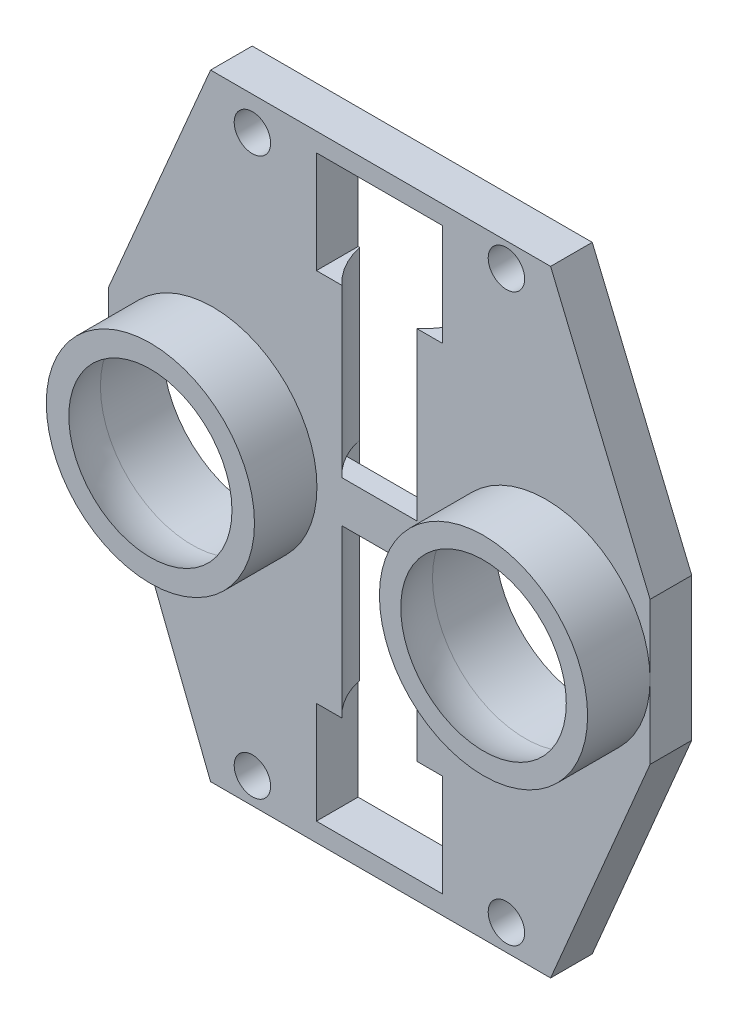
from build123d import *

# Parameters (mm, degrees)
CROQUIS1_W               = 22
CROQUIS1_H               = 55.2
SALIENTE_EXTRUIR1_DEPTH  = 4
CROQUIS2_W               = 12.1
CROQUIS2_H               = 4
CORTAR_EXTRUIR1_DEPTH    = 9.6
CROQUIS3_W               = 12.1
CROQUIS3_H               = 4
CORTAR_EXTRUIR2_DEPTH    = 9.6
CORTAR_EXTRUIR3_DEPTH    = 16
CORTAR_EXTRUIR4_START    = -16
CORTAR_EXTRUIR4_DEPTH    = 16
CROQUIS9_W               = 11.778481694
CROQUIS9_H               = 4
CORTAR_EXTRUIR5_DEPTH    = 2
CROQUIS11_W              = 4.95
CROQUIS11_H              = 4
SALIENTE_EXTRUIR3_DEPTH  = 2
CROQUIS12_W              = 4
CROQUIS12_H              = 1.8
SALIENTE_EXTRUIR4_DEPTH  = 12.1
CROQUIS13_W              = 4.95
CROQUIS13_H              = 4
SALIENTE_EXTRUIR5_DEPTH  = 2
CROQUIS14_W              = 4
CROQUIS14_H              = 1.8
SALIENTE_EXTRUIR6_DEPTH  = 12.1
CROQUIS17_W              = 4
CROQUIS17_H              = 59.2
SALIENTE_EXTRUIR8_DEPTH  = 15
CROQUIS18_W              = 4
CROQUIS18_H              = 59.2
SALIENTE_EXTRUIR9_DEPTH  = 15
CROQUIS19_R              = 1.75
CORTAR_EXTRUIR6_DEPTH    = 11.5
CROQUIS20_R              = 8.8
CROQUIS20_R_2            = 8.901027098
CORTAR_EXTRUIR7_DEPTH    = 4
CROQUIS22_R              = 10
SALIENTE_EXTRUIR10_DEPTH = 6
CORTAR_EXTRUIR8_DEPTH    = 10
CROQUIS26_R              = 8.901027098
CROQUIS26_R_2            = 8.8
CORTAR_EXTRUIR9_DEPTH    = 2


with BuildPart() as part:
    # Croquis1 → Saliente-Extruir1 (new body)
    with BuildSketch(Plane.XY):
        with Locations((11, 27.6)):
            Rectangle(CROQUIS1_W, CROQUIS1_H)
    extrude(amount=SALIENTE_EXTRUIR1_DEPTH)

    # Croquis2 → Cortar-Extruir1 (cut)
    with BuildSketch(Plane(origin=(0, 55.2, 0), x_dir=(1, 0, 0), z_dir=(0, 1, 0))):
        with Locations((11, -2)):
            Rectangle(CROQUIS2_W, CROQUIS2_H)
    extrude(amount=-CORTAR_EXTRUIR1_DEPTH, mode=Mode.SUBTRACT)

    # Croquis3 → Cortar-Extruir2 (cut)
    with BuildSketch(Plane.XZ):
        with Locations((11, 2)):
            Rectangle(CROQUIS3_W, CROQUIS3_H)
    extrude(amount=-CORTAR_EXTRUIR2_DEPTH, mode=Mode.SUBTRACT)

    # Croquis5 → Cortar-Extruir3 (cut)
    with BuildSketch(Plane.XZ.offset(-9.6)):
        with BuildLine():
            Line((7.4, 4), (14.6, 4))
            ThreePointArc((14.6, 4), (16.401151853, 1.506649462), (17.05, -1.5))
            Line((17.05, -1.5), (4.95, -1.5))
            ThreePointArc((4.95, -1.5), (5.598848147, 1.506649462), (7.4, 4))
        make_face()
    extrude(amount=-CORTAR_EXTRUIR3_DEPTH, mode=Mode.SUBTRACT)

    # Croquis7 → Cortar-Extruir4 (cut)
    with BuildSketch(Plane(origin=(0, 45.6, 0), x_dir=(1, 0, 0), z_dir=(0, 1, 0)).offset(CORTAR_EXTRUIR4_START)):
        with BuildLine():
            Line((4.95, 1.5), (17.05, 1.5))
            ThreePointArc((17.05, 1.5), (16.401151853, -1.506649462), (14.6, -4))
            Line((14.6, -4), (7.4, -4))
            ThreePointArc((7.4, -4), (5.598848147, -1.506649462), (4.95, 1.5))
        make_face()
    extrude(amount=CORTAR_EXTRUIR4_DEPTH, mode=Mode.SUBTRACT)

    # Croquis9 → Cortar-Extruir5 (cut)
    with BuildSketch(Plane(origin=(0, 0, 0), x_dir=(-1, 0, 0), z_dir=(0, 0, -1))):
        with Locations((-11, 27.6)):
            Rectangle(CROQUIS9_W, CROQUIS9_H)
    extrude(amount=-CORTAR_EXTRUIR5_DEPTH, mode=Mode.SUBTRACT)

    # Croquis11 → Saliente-Extruir3 (add)
    with BuildSketch(Plane(origin=(0, 55.2, 0), x_dir=(1, 0, 0), z_dir=(0, 1, 0))):
        with Locations((2.475, -2)):
            Rectangle(CROQUIS11_W, CROQUIS11_H)
        with Locations((19.525, -2)):
            Rectangle(CROQUIS11_W, CROQUIS11_H)
    extrude(amount=SALIENTE_EXTRUIR3_DEPTH)

    # Croquis12 → Saliente-Extruir4 (add)
    with BuildSketch(Plane(origin=(4.95, 0, 0), x_dir=(0, 0, -1), z_dir=(1, 0, 0))):
        with Locations((-2, 56.3)):
            Rectangle(CROQUIS12_W, CROQUIS12_H)
    extrude(amount=SALIENTE_EXTRUIR4_DEPTH)

    # Croquis13 → Saliente-Extruir5 (add)
    with BuildSketch(Plane.XZ):
        with Locations((19.525, 2)):
            Rectangle(CROQUIS13_W, CROQUIS13_H)
        with Locations((2.475, 2)):
            Rectangle(CROQUIS13_W, CROQUIS13_H)
    extrude(amount=SALIENTE_EXTRUIR5_DEPTH)

    # Croquis14 → Saliente-Extruir6 (add)
    with BuildSketch(Plane(origin=(4.95, 0, 0), x_dir=(0, 0, -1), z_dir=(1, 0, 0))):
        with Locations((-2, -1.1)):
            Rectangle(CROQUIS14_W, CROQUIS14_H)
    extrude(amount=SALIENTE_EXTRUIR6_DEPTH)

    # Croquis17 → Saliente-Extruir8 (add)
    with BuildSketch(Plane.ZY):
        with Locations((2, 27.6)):
            Rectangle(CROQUIS17_W, CROQUIS17_H)
    extrude(amount=SALIENTE_EXTRUIR8_DEPTH)

    # Croquis18 → Saliente-Extruir9 (add)
    with BuildSketch(Plane(origin=(22, 0, 0), x_dir=(0, 0, -1), z_dir=(1, 0, 0))):
        with Locations((-2, 27.6)):
            Rectangle(CROQUIS18_W, CROQUIS18_H)
    extrude(amount=SALIENTE_EXTRUIR9_DEPTH)

    # Croquis19 → Cortar-Extruir6 (cut)
    with BuildSketch(Plane(origin=(0, 0, 0), x_dir=(-1, 0, 0), z_dir=(0, 0, -1))):
        with Locations((-23.2, 54.9)):
            Circle(CROQUIS19_R)
        with Locations((1.2, 54)):
            Circle(CROQUIS19_R)
        with Locations((1.2, 0.5)):
            Circle(CROQUIS19_R)
        with Locations((-23.2, 0.5)):
            Circle(CROQUIS19_R)
    extrude(amount=-CORTAR_EXTRUIR6_DEPTH, mode=Mode.SUBTRACT)

    # Croquis20 → Cortar-Extruir7 (cut)
    with BuildSketch(Plane(origin=(0, 0, 0), x_dir=(-1, 0, 0), z_dir=(0, 0, -1))):
        with Locations((5, 27.6)):
            Circle(CROQUIS20_R)
        with Locations((-27, 27.6)):
            Circle(CROQUIS20_R_2)
    extrude(amount=-CORTAR_EXTRUIR7_DEPTH, mode=Mode.SUBTRACT)

    # Croquis22 → Saliente-Extruir10 (add)
    with BuildSketch(Plane.XY.offset(4)):
        with Locations(Location((-5, 27.6, 0), (0, 0, 180))):
            Circle(CROQUIS22_R)
        with Locations((27, 27.6)):
            Circle(CROQUIS22_R)
    extrude(amount=SALIENTE_EXTRUIR10_DEPTH)

    # Croquis25 → Cortar-Extruir8 (cut)
    with BuildSketch(Plane(origin=(0, 0, 0), x_dir=(-1, 0, 0), z_dir=(0, 0, -1))):
        Polygon((-27.444270401, 57.2), (-37, 34.275770323), (-37, 57.2), align=None)
        Polygon((5.217973102, 57.2), (15, 34.275770323), (15, 57.2), align=None)
        Polygon((-37, 20.547067511), (-27.444270401, -2), (-37, -2), align=None)
        Polygon((5.217973102, -2), (15, 22.810040502), (15, -2), align=None)
    extrude(amount=-CORTAR_EXTRUIR8_DEPTH, mode=Mode.SUBTRACT)

    # Croquis26 → Cortar-Extruir9 (cut)
    with BuildSketch(Plane(origin=(0, 0, 4), x_dir=(-1, 0, 0), z_dir=(0, 0, -1))):
        with Locations((-27, 27.6)):
            Circle(CROQUIS26_R)
        with Locations((5, 27.6)):
            Circle(CROQUIS26_R_2)
    extrude(amount=-CORTAR_EXTRUIR9_DEPTH, mode=Mode.SUBTRACT)

    # Croquis27 → Cortar-Revolución1 (revolve, cut)
    with BuildSketch(Plane(origin=(0, 0, 6), x_dir=(-1, 0, 0), z_dir=(0, 0, -1))):
        with BuildLine():
            Line((5, 36.4), (5, 18.8))
            ThreePointArc((5, 18.8), (13.8, 27.6), (5, 36.4))
        make_face()
    revolve(axis=Axis((-5, 36.4, 6), (0, -1, 0)), mode=Mode.SUBTRACT)

    # Croquis28 → Cortar-Revolución2 (revolve, cut)
    with BuildSketch(Plane(origin=(0, 0, 6), x_dir=(-1, 0, 0), z_dir=(0, 0, -1))):
        with BuildLine():
            Line((-27, 36.501027098), (-27, 18.698972902))
            ThreePointArc((-27, 18.698972902), (-35.901027098, 27.6), (-27, 36.501027098))
        make_face()
    revolve(axis=Axis((27, 36.501027098, 6), (0, -1, 0)), mode=Mode.SUBTRACT)


solid = part.part
